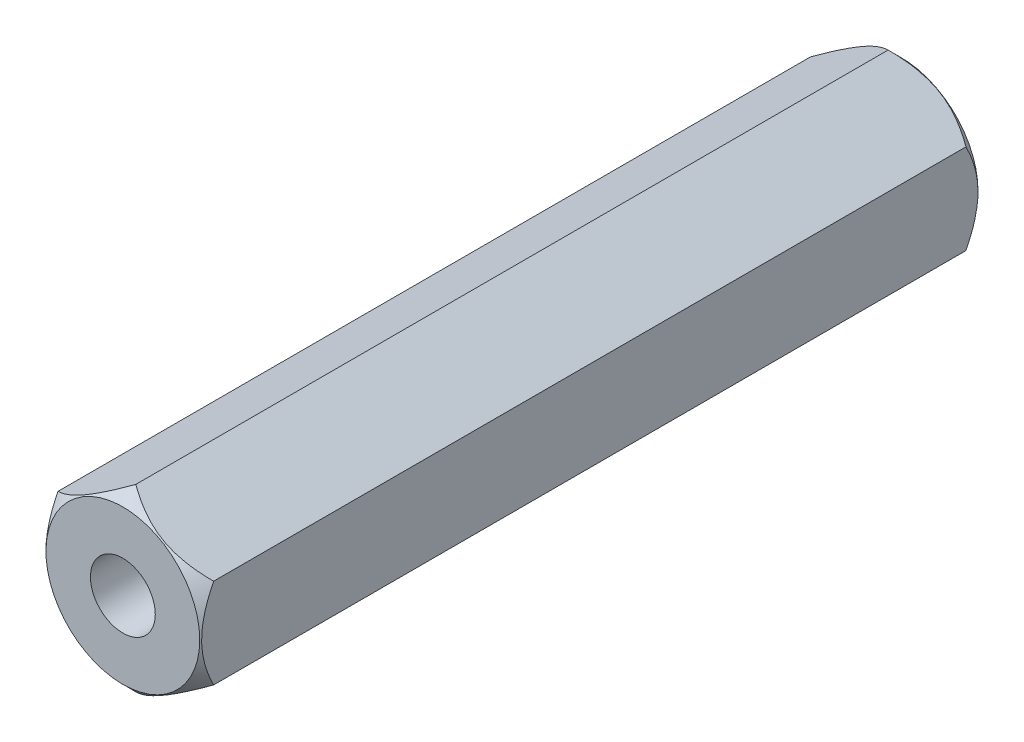
from build123d import *

# Parameters (mm, degrees)
SALIENTE_EXTRUIR1_DEPTH = 15
CROQUIS3_R              = 1.25
CORTAR_EXTRUIR1_DEPTH   = 30


with BuildPart() as part:
    # Croquis1 → Saliente-Extruir1 (new, symmetric)
    with BuildSketch(Plane.XY):
        Polygon((0, 3.464101615), (-3, 1.732050808), (-3, -1.732050808), (0, -3.464101615), (3, -1.732050808), (3, 1.732050808), align=None)
    extrude(amount=SALIENTE_EXTRUIR1_DEPTH, both=True)

    # Croquis2 → Cortar-Revolución2 (revolve, cut)
    with BuildSketch(Plane(origin=(0, 0, 0), x_dir=(0, 0, -1), z_dir=(1, 0, 0)), mode=Mode.PRIVATE) as cortar_revoluci_n2_sk:
        Polygon((15, 2.964101615), (19.5, 2.964101615), (19.5, 7.964101615), (14.5, 7.964101615), (14.5, 3.464101615), align=None)
        Polygon((-19.5, 2.964101615), (-19.5, 7.964101615), (-14.5, 7.964101615), (-14.5, 3.464101615), (-15, 2.964101615), align=None)
    revolve(cortar_revoluci_n2_sk.sketch.rotate(Axis((0, 0, 17.803147854), (0, 0, -1)), 90), axis=Axis((0, 0, 17.803147854), (0, 0, -1)), mode=Mode.SUBTRACT)

    # Croquis3 → Cortar-Extruir1 (cut)
    with BuildSketch(Plane.XY.offset(15)):
        Circle(CROQUIS3_R)
    extrude(amount=-CORTAR_EXTRUIR1_DEPTH, mode=Mode.SUBTRACT)


solid = part.part
